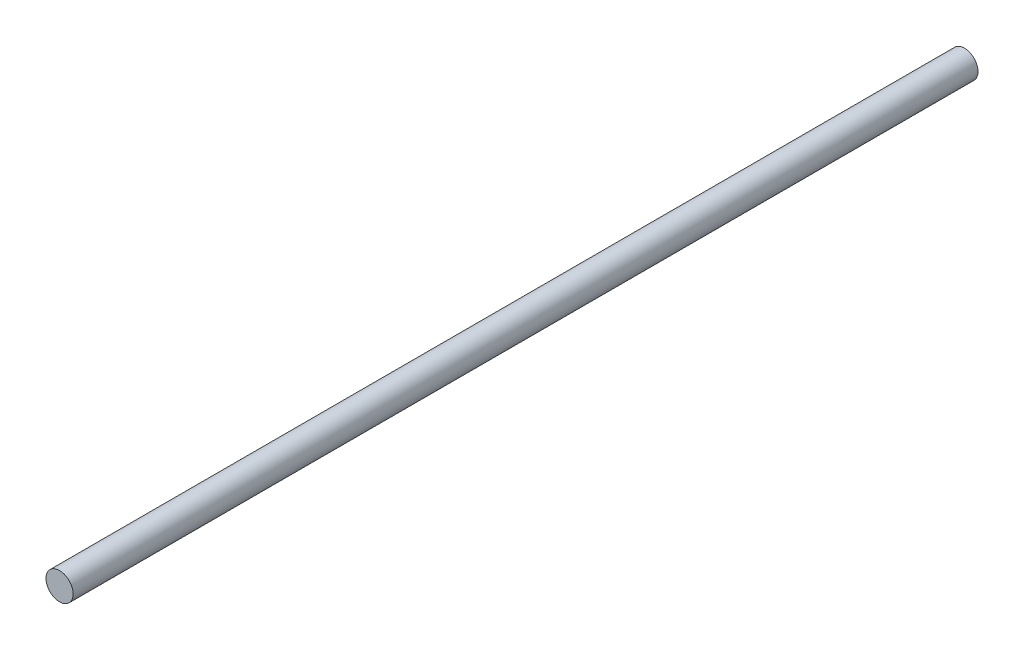
from build123d import *

# Parameters (mm, degrees)
BOSS_EXTRUDE1_DEPTH      = 100
BOSS_EXTRUDE1_DEPTH_BACK = 100
SKETCH1_R                = 3


with BuildPart() as part:
    # Sketch1 → Boss-Extrude1 (new, two sides: drawn at the far end of the back side and taken through both)
    with BuildSketch(Plane.XY.offset(-BOSS_EXTRUDE1_DEPTH_BACK)):
        with Locations((0, 0.645644179)):
            Circle(SKETCH1_R)
    extrude(amount=BOSS_EXTRUDE1_DEPTH + BOSS_EXTRUDE1_DEPTH_BACK)


solid = part.part
